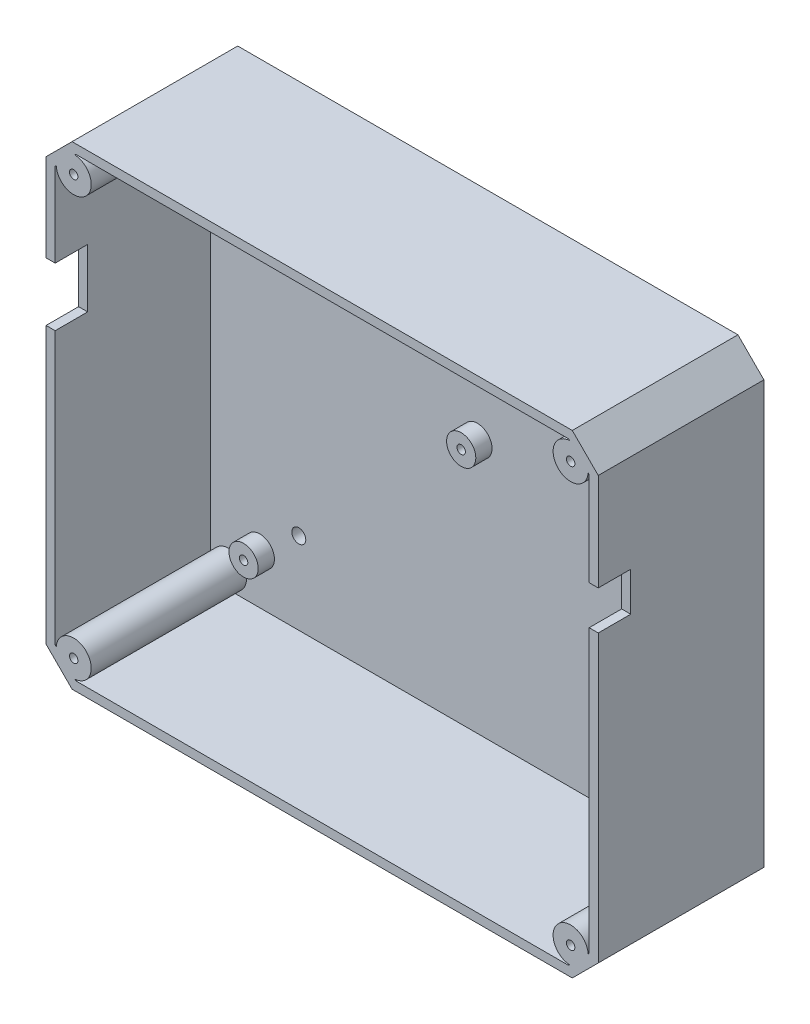
from build123d import *

# Parameters (mm, degrees)
FLOOR_3_2_FOUR_CASE_MOUNTING_HOLES_2_R      = 2.15
FLOOR_3_2_FOUR_CASE_MOUNTING_HOLES_D4_DEPTH = 3.2
PERIMETER_START                             = 3.2
PERIMETER_WALL_2_8_DEPTH                    = 47.8
LID_START                                   = 3.2
LID_POST_CORES_PROFILE_R                    = 5.4
LID_POST_CORES_DEPTH                        = 37.8
LID_START_2                                 = 41
LID_POST_TIPS_D2_6_PILOT_X_10_PROFILE_R     = 5.4
LID_POST_TIPS_D2_6_PILOT_X_10_PROFILE_R_2   = 1.3
LID_POST_TIPS_D2_6_PILOT_X_10_DEPTH         = 10
TRAY_START                                  = 3.2
TRAY_SUPPORTS_D2_6_PILOT_X_5_PROFILE_R      = 4.5
TRAY_SUPPORTS_D2_6_PILOT_X_5_PROFILE_R_2    = 1.3
TRAY_SUPPORTS_D2_6_PILOT_X_5_DEPTH          = 5
CABLE_START                                 = 51
CABLE_EXITS_18_X_10_AND_12_X_10_PROFILE_W   = 6
CABLE_EXITS_18_X_10_AND_12_X_10_PROFILE_H   = 18
CABLE_EXITS_18_X_10_AND_12_X_10_PROFILE_H_2 = 12
CABLE_EXITS_18_X_10_AND_12_X_10_DEPTH       = 10


with BuildPart() as part:
    # Floor 3.2 - four case mounting holes 2 → Floor 3.2 - four case mounting holes D4 (new body)
    with BuildSketch(Plane.XY):
        Polygon((-77, -73), (77, -73), (85, -65), (85, 65), (77, 73), (-77, 73), (-85, 65), (-85, -65), align=None)
        with Locations((-55, -45)):
            Circle(FLOOR_3_2_FOUR_CASE_MOUNTING_HOLES_2_R, mode=Mode.SUBTRACT)
        with Locations((-55, 45)):
            Circle(FLOOR_3_2_FOUR_CASE_MOUNTING_HOLES_2_R, mode=Mode.SUBTRACT)
        with Locations((55, -45)):
            Circle(FLOOR_3_2_FOUR_CASE_MOUNTING_HOLES_2_R, mode=Mode.SUBTRACT)
        with Locations((55, 45)):
            Circle(FLOOR_3_2_FOUR_CASE_MOUNTING_HOLES_2_R, mode=Mode.SUBTRACT)
    extrude(amount=FLOOR_3_2_FOUR_CASE_MOUNTING_HOLES_D4_DEPTH)

    # Perimeter wall 2.8 profile → Perimeter wall 2.8 (add)
    with BuildSketch(Plane.XY.offset(PERIMETER_START)):
        Polygon((-77, -73), (77, -73), (85, -65), (85, 65), (77, 73), (-77, 73), (-85, 65), (-85, -65), align=None)
        Polygon((-75.84, -70.2), (75.84, -70.2), (82.2, -63.84), (82.2, 63.84), (75.84, 70.2), (-75.84, 70.2), (-82.2, 63.84), (-82.2, -63.84), align=None, mode=Mode.SUBTRACT)
    extrude(amount=PERIMETER_WALL_2_8_DEPTH)

    # Lid post cores profile → Lid post cores (add)
    with BuildSketch(Plane.XY.offset(LID_START)):
        with Locations((-76.5, -64.5)):
            Circle(LID_POST_CORES_PROFILE_R)
        with Locations((-76.5, 64.5)):
            Circle(LID_POST_CORES_PROFILE_R)
        with Locations((76.5, -64.5)):
            Circle(LID_POST_CORES_PROFILE_R)
        with Locations((76.5, 64.5)):
            Circle(LID_POST_CORES_PROFILE_R)
    extrude(amount=LID_POST_CORES_DEPTH)

    # Lid post tips - D2.6 pilot x 10 profile → Lid post tips - D2.6 pilot x 10 (add)
    # profile 1 of 4: a face of its own
    with BuildSketch(Plane.XY.offset(LID_START_2)):
        with Locations((-76.5, -64.5)):
            Circle(LID_POST_TIPS_D2_6_PILOT_X_10_PROFILE_R)
        with Locations((-76.5, -64.5)):
            Circle(LID_POST_TIPS_D2_6_PILOT_X_10_PROFILE_R_2, mode=Mode.SUBTRACT)
    # profile 2 of 4: a face of its own
    with BuildSketch(Plane.XY.offset(LID_START_2)):
        with Locations((-76.5, 64.5)):
            Circle(LID_POST_TIPS_D2_6_PILOT_X_10_PROFILE_R)
        with Locations((-76.5, 64.5)):
            Circle(LID_POST_TIPS_D2_6_PILOT_X_10_PROFILE_R_2, mode=Mode.SUBTRACT)
    # profile 3 of 4: a face of its own
    with BuildSketch(Plane.XY.offset(LID_START_2)):
        with Locations((76.5, -64.5)):
            Circle(LID_POST_TIPS_D2_6_PILOT_X_10_PROFILE_R)
        with Locations((76.5, -64.5)):
            Circle(LID_POST_TIPS_D2_6_PILOT_X_10_PROFILE_R_2, mode=Mode.SUBTRACT)
    # profile 4 of 4: a face of its own
    with BuildSketch(Plane.XY.offset(LID_START_2)):
        with Locations((76.5, 64.5)):
            Circle(LID_POST_TIPS_D2_6_PILOT_X_10_PROFILE_R)
        with Locations((76.5, 64.5)):
            Circle(LID_POST_TIPS_D2_6_PILOT_X_10_PROFILE_R_2, mode=Mode.SUBTRACT)
    extrude(amount=LID_POST_TIPS_D2_6_PILOT_X_10_DEPTH)

    # Tray supports - D2.6 pilot x 5 profile → Tray supports - D2.6 pilot x 5 (add)
    # profile 1 of 6: a face of its own
    with BuildSketch(Plane.XY.offset(TRAY_START)):
        with Locations((-67, -55)):
            Circle(TRAY_SUPPORTS_D2_6_PILOT_X_5_PROFILE_R)
        with Locations((-67, -55)):
            Circle(TRAY_SUPPORTS_D2_6_PILOT_X_5_PROFILE_R_2, mode=Mode.SUBTRACT)
    # profile 2 of 6: a face of its own
    with BuildSketch(Plane.XY.offset(TRAY_START)):
        with Locations((-67, 54)):
            Circle(TRAY_SUPPORTS_D2_6_PILOT_X_5_PROFILE_R)
        with Locations((-67, 54)):
            Circle(TRAY_SUPPORTS_D2_6_PILOT_X_5_PROFILE_R_2, mode=Mode.SUBTRACT)
    # profile 3 of 6: a face of its own
    with BuildSketch(Plane.XY.offset(TRAY_START)):
        with Locations((67, -55)):
            Circle(TRAY_SUPPORTS_D2_6_PILOT_X_5_PROFILE_R)
        with Locations((67, -55)):
            Circle(TRAY_SUPPORTS_D2_6_PILOT_X_5_PROFILE_R_2, mode=Mode.SUBTRACT)
    # profile 4 of 6: a face of its own
    with BuildSketch(Plane.XY.offset(TRAY_START)):
        with Locations((67, 54)):
            Circle(TRAY_SUPPORTS_D2_6_PILOT_X_5_PROFILE_R)
        with Locations((67, 54)):
            Circle(TRAY_SUPPORTS_D2_6_PILOT_X_5_PROFILE_R_2, mode=Mode.SUBTRACT)
    # profile 5 of 6: a face of its own
    with BuildSketch(Plane.XY.offset(TRAY_START)):
        with Locations((0, 8)):
            Circle(TRAY_SUPPORTS_D2_6_PILOT_X_5_PROFILE_R)
        with Locations((0, 8)):
            Circle(TRAY_SUPPORTS_D2_6_PILOT_X_5_PROFILE_R_2, mode=Mode.SUBTRACT)
    # profile 6 of 6: a face of its own
    with BuildSketch(Plane.XY.offset(TRAY_START)):
        with Locations((70, 33)):
            Circle(TRAY_SUPPORTS_D2_6_PILOT_X_5_PROFILE_R)
        with Locations((70, 33)):
            Circle(TRAY_SUPPORTS_D2_6_PILOT_X_5_PROFILE_R_2, mode=Mode.SUBTRACT)
    extrude(amount=TRAY_SUPPORTS_D2_6_PILOT_X_5_DEPTH)

    # Cable exits 18 x 10 and 12 x 10 profile → Cable exits 18 x 10 and 12 x 10 (cut)
    with BuildSketch(Plane.XY.offset(CABLE_START)):
        with Locations((-84, 29)):
            Rectangle(CABLE_EXITS_18_X_10_AND_12_X_10_PROFILE_W, CABLE_EXITS_18_X_10_AND_12_X_10_PROFILE_H)
        with Locations((84, 29)):
            Rectangle(CABLE_EXITS_18_X_10_AND_12_X_10_PROFILE_W, CABLE_EXITS_18_X_10_AND_12_X_10_PROFILE_H_2)
    extrude(amount=-CABLE_EXITS_18_X_10_AND_12_X_10_DEPTH, mode=Mode.SUBTRACT)


solid = part.part
